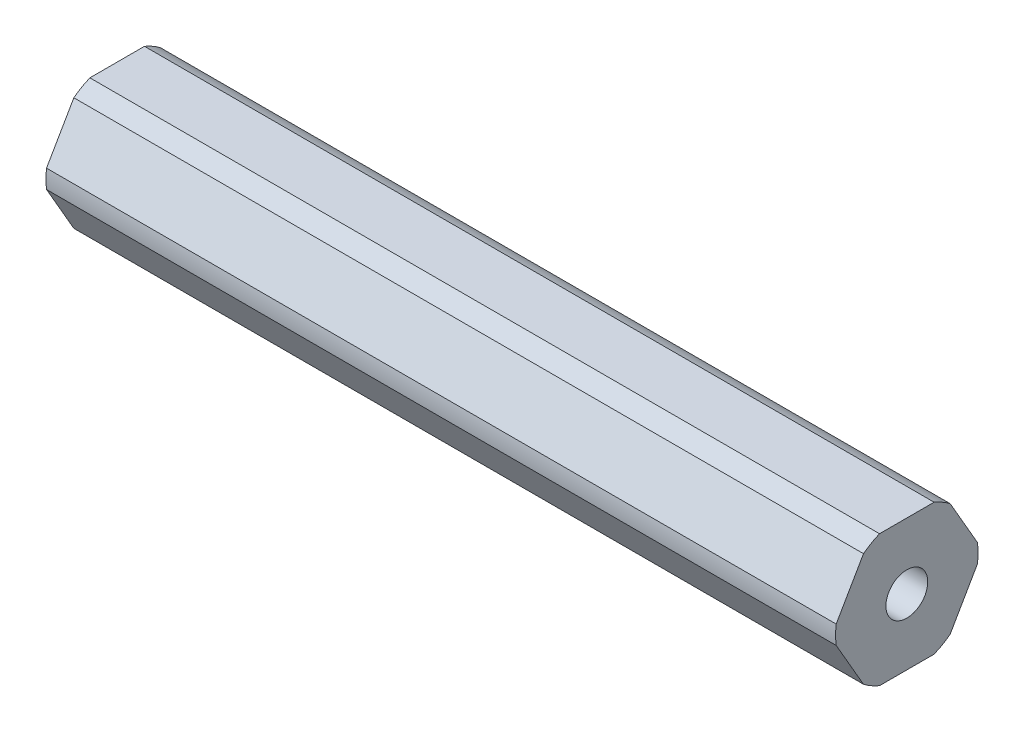
from build123d import *

# Parameters (mm, degrees)
SKETCH1_R           = 2.0193
BOSS_EXTRUDE1_DEPTH = 38.1


with BuildPart() as part:
    # Sketch1 → Boss-Extrude1 (new, symmetric)
    with BuildSketch(Plane(origin=(0, 0, 0), x_dir=(0, 0, -1), z_dir=(1, 0, 0))):
        with BuildLine():
            ThreePointArc((6.874999966, 0), (6.860422465, 0.447468582), (6.816751782, 0.893039571))
            Line((6.816751782, 0.893039571), (4.181770846, 5.456960429))
            ThreePointArc((4.181770846, 5.456960429), (3.437499983, 5.953924622), (2.634980936, 6.35))
            Line((2.634980936, 6.35), (-2.634980936, 6.35))
            ThreePointArc((-2.634980936, 6.35), (-3.437499983, 5.953924622), (-4.181770846, 5.456960429))
            Line((-4.181770846, 5.456960429), (-6.816751782, 0.893039571))
            ThreePointArc((-6.816751782, 0.893039571), (-6.874999966, 0), (-6.816751782, -0.893039571))
            Line((-6.816751782, -0.893039571), (-4.181770846, -5.456960429))
            ThreePointArc((-4.181770846, -5.456960429), (-3.437499983, -5.953924622), (-2.634980936, -6.35))
            Line((-2.634980936, -6.35), (2.634980936, -6.35))
            ThreePointArc((2.634980936, -6.35), (3.437499983, -5.953924622), (4.181770846, -5.456960429))
            Line((4.181770846, -5.456960429), (6.816751782, -0.893039571))
            ThreePointArc((6.816751782, -0.893039571), (6.860422465, -0.447468582), (6.874999966, 0))
        make_face()
        Circle(SKETCH1_R, mode=Mode.SUBTRACT)
    extrude(amount=BOSS_EXTRUDE1_DEPTH, both=True)


solid = part.part
